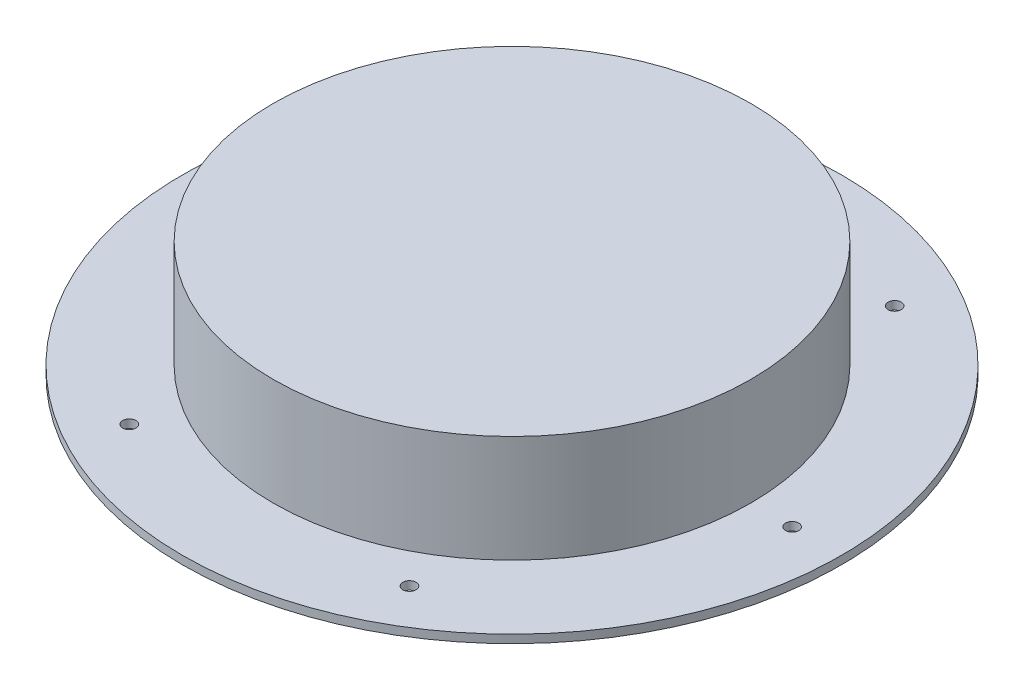
from build123d import *

# Parameters (mm, degrees)
SKETCH1_R               = 100
SKETCH1_R_2             = 70
BOSS_EXTRUDE1_DEPTH     = 2.5
SKETCH2_R               = 72.5
SKETCH2_R_2             = 70
BOSS_EXTRUDE2_DEPTH     = 30
SKETCH3_R               = 72.5
BOSS_EXTRUDE3_DEPTH     = 2.5
BOSS_EXTRUDE4_DEPTH     = 5
CUT_EXTRUDE1_DEPTH      = 5
CUT_EXTRUDE1_DEPTH_BACK = 146.107718609
SKETCH4_R               = 2


with BuildPart() as part:
    # Sketch1 → Boss-Extrude1 (new body)
    with BuildSketch(Plane(origin=(0, 0, 0), x_dir=(1, 0, 0), z_dir=(0, 1, 0))):
        with Locations(Location((0, 0, 0), (0, 0, 270))):
            Circle(SKETCH1_R)
        with Locations(Location((0, 0, 0), (0, 0, 270))):
            Circle(SKETCH1_R_2, mode=Mode.SUBTRACT)
    extrude(amount=BOSS_EXTRUDE1_DEPTH)

    # Sketch2 → Boss-Extrude2 (add)
    with BuildSketch(Plane(origin=(0, 2.5, 0), x_dir=(1, 0, 0), z_dir=(0, 1, 0))):
        with Locations(Location((0, 0, 0), (0, 0, 270))):
            Circle(SKETCH2_R)
        with Locations(Location((0, 0, 0), (0, 0, 270))):
            Circle(SKETCH2_R_2, mode=Mode.SUBTRACT)
    extrude(amount=BOSS_EXTRUDE2_DEPTH)

    # Sketch3 → Boss-Extrude3 (add)
    with BuildSketch(Plane(origin=(0, 32.5, 0), x_dir=(1, 0, 0), z_dir=(0, 1, 0))):
        with Locations(Location((0, 0, 0), (0, 0, 270))):
            Circle(SKETCH3_R)
    extrude(amount=BOSS_EXTRUDE3_DEPTH)

    # Sketch5 → Boss-Extrude4 (add)
    with BuildSketch(Plane.XZ):
        with BuildLine():
            ThreePointArc((69.285714286, -9.974457174), (69.821200219, -5), (70, 0))
            ThreePointArc((70, 0), (69.821200219, 5), (69.285714286, 9.974457174))
            ThreePointArc((69.285714286, 9.974457174), (60, 0), (69.285714286, -9.974457174))
        make_face()
        with BuildLine():
            ThreePointArc((26.004723841, 64.990417278), (30, 51.961524227), (43.280990445, 55.015960104))
            ThreePointArc((43.280990445, 55.015960104), (35, 60.621778265), (26.004723841, 64.990417278))
        make_face()
        with BuildLine():
            ThreePointArc((-43.280990445, 55.015960104), (-30, 51.961524227), (-26.004723841, 64.990417278))
            ThreePointArc((-26.004723841, 64.990417278), (-35, 60.621778265), (-43.280990445, 55.015960104))
        make_face()
        with BuildLine():
            ThreePointArc((-69.285714286, -9.974457174), (-60, 0), (-69.285714286, 9.974457174))
            ThreePointArc((-69.285714286, 9.974457174), (-70, 0), (-69.285714286, -9.974457174))
        make_face()
        with BuildLine():
            ThreePointArc((-43.280990445, -55.015960104), (-35, -60.621778265), (-26.004723841, -64.990417278))
            ThreePointArc((-26.004723841, -64.990417278), (-30, -51.961524227), (-43.280990445, -55.015960104))
        make_face()
        with BuildLine():
            ThreePointArc((26.004723841, -64.990417278), (35, -60.621778265), (43.280990445, -55.015960104))
            ThreePointArc((43.280990445, -55.015960104), (30, -51.961524227), (26.004723841, -64.990417278))
        make_face()
    extrude(amount=-BOSS_EXTRUDE4_DEPTH)

    # Sketch4 → Cut-Extrude1 (cut, two sides: drawn at the far end of the back side and taken through both)
    with BuildSketch(Plane(origin=(0, 2.5, 0), x_dir=(1, 0, 0), z_dir=(0, 1, 0)).offset(-CUT_EXTRUDE1_DEPTH_BACK)):
        with Locations(Location((85, 0, 0), (0, 0, 270))):
            Circle(SKETCH4_R)
        with Locations(Location((65, 0, 0), (0, 0, 270))):
            Circle(SKETCH4_R)
        with Locations(Location((32.5, -56.291651246, 0), (0, 0, 270))):
            Circle(SKETCH4_R)
        with Locations(Location((42.5, -73.612159322, 0), (0, 0, 270))):
            Circle(SKETCH4_R)
        with Locations(Location((-32.5, -56.291651246, 0), (0, 0, 270))):
            Circle(SKETCH4_R)
        with Locations(Location((-42.5, -73.612159322, 0), (0, 0, 270))):
            Circle(SKETCH4_R)
        with Locations(Location((-65, 0, 0), (0, 0, 270))):
            Circle(SKETCH4_R)
        with Locations(Location((-85, 0, 0), (0, 0, 270))):
            Circle(SKETCH4_R)
        with Locations(Location((-32.5, 56.291651246, 0), (0, 0, 270))):
            Circle(SKETCH4_R)
        with Locations(Location((-42.5, 73.612159322, 0), (0, 0, 270))):
            Circle(SKETCH4_R)
        with Locations(Location((32.5, 56.291651246, 0), (0, 0, 270))):
            Circle(SKETCH4_R)
        with Locations(Location((42.5, 73.612159322, 0), (0, 0, 270))):
            Circle(SKETCH4_R)
    extrude(amount=CUT_EXTRUDE1_DEPTH + CUT_EXTRUDE1_DEPTH_BACK, mode=Mode.SUBTRACT)


solid = part.part
